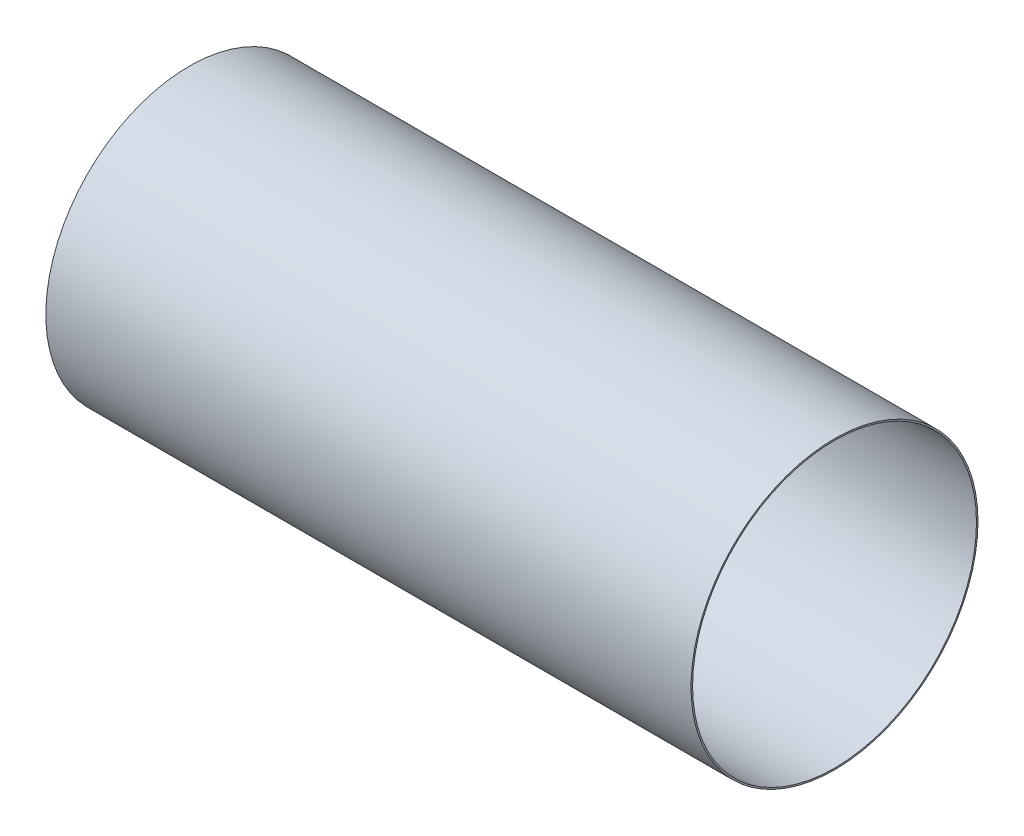
from build123d import *

# Parameters (mm, degrees)
SKETCH1_R           = 28.24
SKETCH1_R_2         = 27.94
BOSS_EXTRUDE1_DEPTH = 127


with BuildPart() as part:
    # Sketch1 → Boss-Extrude1 (new body)
    with BuildSketch(Plane(origin=(0, 0, 0), x_dir=(0, 0, -1), z_dir=(1, 0, 0))):
        Circle(SKETCH1_R)
        Circle(SKETCH1_R_2, mode=Mode.SUBTRACT)
    extrude(amount=BOSS_EXTRUDE1_DEPTH)


solid = part.part
